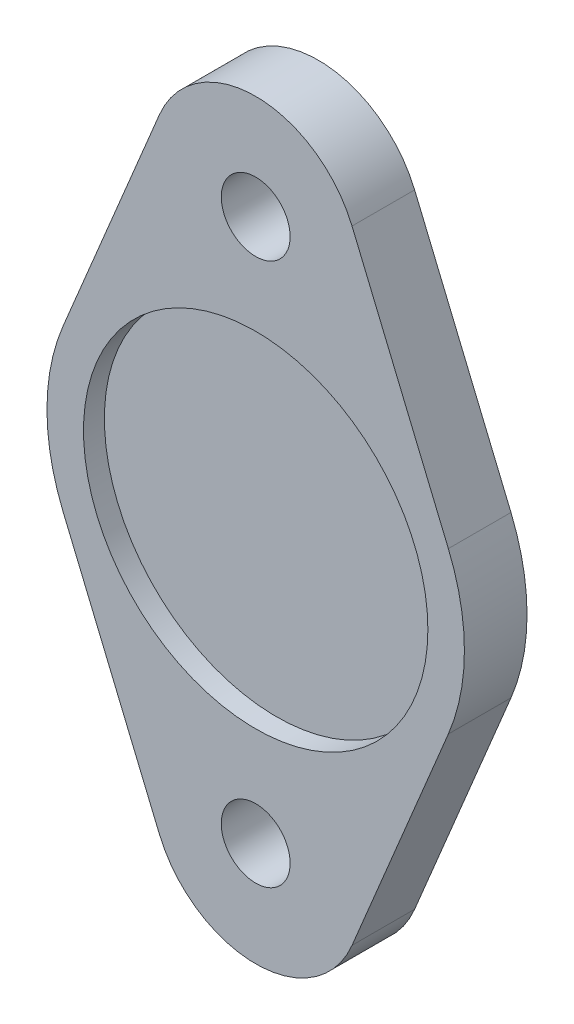
from build123d import *

# Parameters (mm, degrees)
SKETCH_1_R      = 1.65
SKETCH_1_R_2    = 8.25
EXTRUDE_1_DEPTH = 3
SKETCH_1_3_R    = 8.25
EXTRUDE_2_DEPTH = 2


with BuildPart() as part:
    # 草图1 → 凸台-拉伸1 (new body)
    with BuildSketch(Plane.XY):
        with BuildLine():
            Line((-4.615384615, 14.923076923), (-9.230769231, 3.846153846))
            ThreePointArc((-9.230769231, 3.846153846), (-10, 0), (-9.230769231, -3.846153846))
            Line((-9.230769231, -3.846153846), (-4.615384615, -14.923076923))
            ThreePointArc((-4.615384615, -14.923076923), (0, -18), (4.615384615, -14.923076923))
            Line((4.615384615, -14.923076923), (9.230769231, -3.846153846))
            ThreePointArc((9.230769231, -3.846153846), (10, 0), (9.230769231, 3.846153846))
            Line((9.230769231, 3.846153846), (4.615384615, 14.923076923))
            ThreePointArc((4.615384615, 14.923076923), (0, 18), (-4.615384615, 14.923076923))
        make_face()
        with Locations((0, 13)):
            Circle(SKETCH_1_R, mode=Mode.SUBTRACT)
        Circle(SKETCH_1_R_2, mode=Mode.SUBTRACT)
        with Locations((0, -13)):
            Circle(SKETCH_1_R, mode=Mode.SUBTRACT)
    extrude(amount=EXTRUDE_1_DEPTH)

    # 草图1<3> → 凸台-拉伸2 (add)
    with BuildSketch(Plane.XY):
        Circle(SKETCH_1_3_R)
    extrude(amount=EXTRUDE_2_DEPTH)


solid = part.part
